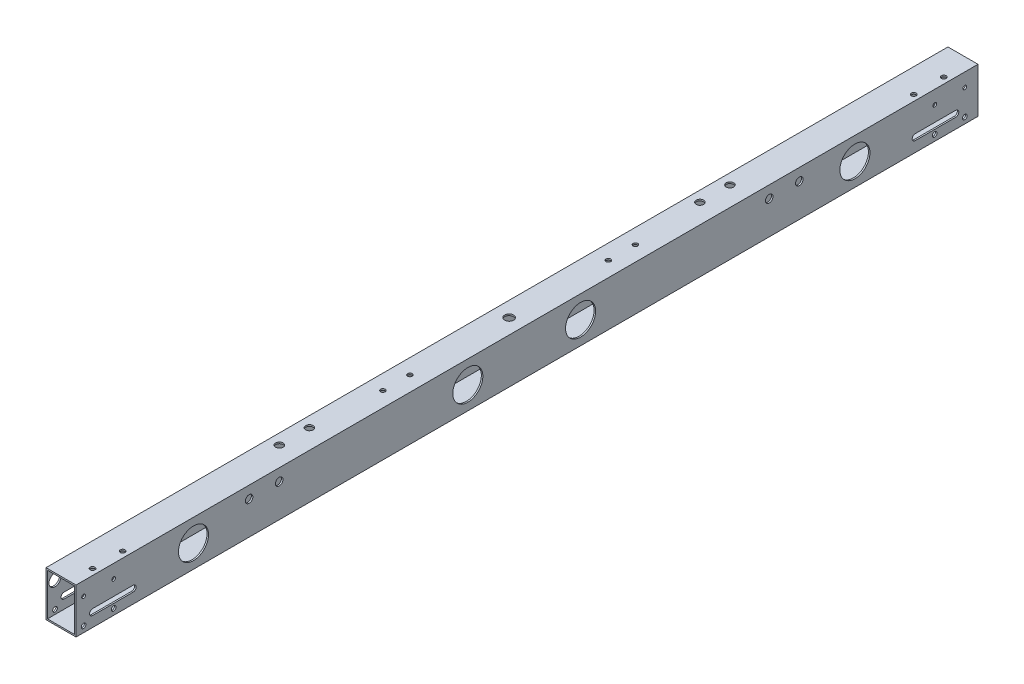
from build123d import *

# Parameters (mm, degrees)
SKETCH_1_W           = 20
SKETCH_1_H           = 30
SKETCH_1_W_2         = 18
SKETCH_1_H_2         = 28
EXTRUDE_1_DEPTH      = 600
SKETCH_2_R           = 1.55
SKETCH_2_R_2         = 3
CUT_EXTRUDE_1_DEPTH  = 5
SKETCH_5_R           = 5
CUT_EXTRUDE_6_DEPTH  = 10
SKETCH_7_R           = 1.25
CUT_EXTRUDE_7_DEPTH  = 25
SKETCH_8_R           = 4
CUT_EXTRUDE_8_DEPTH  = 3
SKETCH_10_R          = 1.6
CUT_EXTRUDE_9_DEPTH  = 40
SKETCH_11_R          = 2.5
CUT_EXTRUDE_10_DEPTH = 40
SKETCH_13_R          = 2.5
CUT_EXTRUDE_11_DEPTH = 40
CUT_EXTRUDE_12_DEPTH = 10
SKETCH_16_R          = 2.5
CUT_EXTRUDE_13_DEPTH = 50
SKETCH_17_R          = 2.5
CUT_EXTRUDE_14_DEPTH = 50
SKETCH_18_R          = 1.55
CUT_EXTRUDE_15_DEPTH = 40
SKETCH_19_R          = 1.55
CUT_EXTRUDE_16_DEPTH = 40
SKETCH_20_R          = 10
CUT_EXTRUDE_17_DEPTH = 40


with BuildPart() as part:
    # 草图1 → 凸台-拉伸1 (new body)
    with BuildSketch(Plane.XY):
        Rectangle(SKETCH_1_W, SKETCH_1_H)
        Rectangle(SKETCH_1_W_2, SKETCH_1_H_2, mode=Mode.SUBTRACT)
    extrude(amount=EXTRUDE_1_DEPTH)

    # 草图2 → 切除-拉伸1 (cut)
    with BuildSketch(Plane(origin=(0, 15, 0), x_dir=(1, 0, 0), z_dir=(0, 1, 0))):
        with Locations(Location((0, -217.88, 0), (0, 0, 270))):
            Circle(SKETCH_2_R)
        with Locations(Location((0, -235.88, 0), (0, 0, 270))):
            Circle(SKETCH_2_R)
        with Locations(Location((0, -367.88, 0), (0, 0, 270))):
            Circle(SKETCH_2_R)
        with Locations(Location((0, -385.88, 0), (0, 0, 270))):
            Circle(SKETCH_2_R)
        with Locations(Location((0, -301.88, 0), (0, 0, 270))):
            Circle(SKETCH_2_R_2)
    extrude(amount=-CUT_EXTRUDE_1_DEPTH, mode=Mode.SUBTRACT)

    # 草图5 → 切除-拉伸6 (cut)
    with BuildSketch(Plane(origin=(0, -14, 0), x_dir=(1, 0, 0), z_dir=(0, 1, 0))):
        with Locations(Location((0, -385.88, 0), (0, 0, 270))):
            Circle(SKETCH_5_R)
        with Locations(Location((0, -367.88, 0), (0, 0, 270))):
            Circle(SKETCH_5_R)
        with Locations(Location((0, -235.88, 0), (0, 0, 270))):
            Circle(SKETCH_5_R)
        with Locations(Location((0, -217.88, 0), (0, 0, 270))):
            Circle(SKETCH_5_R)
    extrude(amount=-CUT_EXTRUDE_6_DEPTH, mode=Mode.SUBTRACT)

    # 草图7 → 切除-拉伸7 (cut)
    with BuildSketch(Plane(origin=(10, 0, 0), x_dir=(0, 0, -1), z_dir=(1, 0, 0))):
        with BuildLine():
            ThreePointArc((-587, -6.1), (-587.585786438, -4.685786438), (-589, -4.1))
            Line((-589, -4.1), (-589, -8.1))
            ThreePointArc((-589, -8.1), (-587.585786438, -7.514213562), (-587, -6.1))
        make_face()
        with BuildLine():
            Line((-589, -8.1), (-589, -4.1))
            ThreePointArc((-589, -4.1), (-591, -6.1), (-589, -8.1))
        make_face()
        with BuildLine():
            Line((-562, -4.1), (-589, -4.1))
            ThreePointArc((-589, -4.1), (-587.585786438, -4.685786438), (-587, -6.1))
            ThreePointArc((-587, -6.1), (-587.585786438, -7.514213562), (-589, -8.1))
            Line((-589, -8.1), (-562, -8.1))
            ThreePointArc((-562, -8.1), (-564, -6.1), (-562, -4.1))
        make_face()
        with Locations((-595, 6)):
            Circle(SKETCH_7_R)
        with BuildLine():
            ThreePointArc((-560, -6.1), (-560.585786438, -4.685786438), (-562, -4.1))
            Line((-562, -4.1), (-562, -8.1))
            ThreePointArc((-562, -8.1), (-560.585786438, -7.514213562), (-560, -6.1))
        make_face()
        with BuildLine():
            Line((-562, -8.1), (-562, -4.1))
            ThreePointArc((-562, -4.1), (-564, -6.1), (-562, -8.1))
        make_face()
        with BuildLine():
            ThreePointArc((-39.76, -6.1), (-40.345786438, -4.685786438), (-41.76, -4.1))
            Line((-41.76, -4.1), (-41.76, -8.1))
            ThreePointArc((-41.76, -8.1), (-40.345786438, -7.514213562), (-39.76, -6.1))
        make_face()
        with BuildLine():
            Line((-41.76, -8.1), (-41.76, -4.1))
            ThreePointArc((-41.76, -4.1), (-43.76, -6.1), (-41.76, -8.1))
        make_face()
        with BuildLine():
            ThreePointArc((-14.76, -8.1), (-16.76, -6.1), (-14.76, -4.1))
            Line((-14.76, -4.1), (-41.76, -4.1))
            ThreePointArc((-41.76, -4.1), (-40.345786438, -4.685786438), (-39.76, -6.1))
            ThreePointArc((-39.76, -6.1), (-40.345786438, -7.514213562), (-41.76, -8.1))
            Line((-41.76, -8.1), (-14.76, -8.1))
        make_face()
        with BuildLine():
            ThreePointArc((-12.76, -6.1), (-13.345786438, -4.685786438), (-14.76, -4.1))
            Line((-14.76, -4.1), (-14.76, -8.1))
            ThreePointArc((-14.76, -8.1), (-13.345786438, -7.514213562), (-12.76, -6.1))
        make_face()
        with BuildLine():
            Line((-14.76, -8.1), (-14.76, -4.1))
            ThreePointArc((-14.76, -4.1), (-16.76, -6.1), (-14.76, -8.1))
        make_face()
        with Locations((-575, 6)):
            Circle(SKETCH_7_R)
        with Locations((-8.76, 6)):
            Circle(SKETCH_7_R)
        with Locations((-28.76, 6)):
            Circle(SKETCH_7_R)
    extrude(amount=-CUT_EXTRUDE_7_DEPTH, mode=Mode.SUBTRACT)

    # 草图8 → 切除-拉伸8 (cut)
    with BuildSketch(Plane.ZY.offset(10)):
        with Locations((8.76, 6)):
            Circle(SKETCH_8_R)
        with Locations((28.76, 6)):
            Circle(SKETCH_8_R)
        with Locations((575, 6)):
            Circle(SKETCH_8_R)
        with Locations((595, 6)):
            Circle(SKETCH_8_R)
    extrude(amount=-CUT_EXTRUDE_8_DEPTH, mode=Mode.SUBTRACT)

    # 草图10 → 切除-拉伸9 (cut)
    with BuildSketch(Plane(origin=(0, 15, 0), x_dir=(1, 0, 0), z_dir=(0, 1, 0))):
        with Locations(Location((6, -585, 0), (0, 0, 270))):
            Circle(SKETCH_10_R)
        with Locations(Location((6, -565, 0), (0, 0, 270))):
            Circle(SKETCH_10_R)
        with Locations(Location((6, -38.76, 0), (0, 0, 270))):
            Circle(SKETCH_10_R)
        with Locations(Location((6, -18.76, 0), (0, 0, 270))):
            Circle(SKETCH_10_R)
    extrude(amount=-CUT_EXTRUDE_9_DEPTH, mode=Mode.SUBTRACT)

    # 草图11 → 切除-拉伸10 (cut)
    with BuildSketch(Plane.XZ.offset(15)):
        with Locations(Location((-3, 152, 0), (0, 0, 270))):
            Circle(SKETCH_11_R)
        with Locations(Location((-3, 172, 0), (0, 0, 270))):
            Circle(SKETCH_11_R)
    extrude(amount=-CUT_EXTRUDE_10_DEPTH, mode=Mode.SUBTRACT)

    # 草图13 → 切除-拉伸11 (cut)
    with BuildSketch(Plane.XZ.offset(15)):
        with Locations(Location((-3, 431.76, 0), (0, 0, 270))):
            Circle(SKETCH_13_R)
        with Locations(Location((-3, 451.76, 0), (0, 0, 270))):
            Circle(SKETCH_13_R)
    extrude(amount=-CUT_EXTRUDE_11_DEPTH, mode=Mode.SUBTRACT)

    # 草图14 → 切除-拉伸12 (cut)
    with BuildSketch(Plane(origin=(0, -14, 0), x_dir=(1, 0, 0), z_dir=(0, 1, 0))):
        with BuildLine():
            Line((6, -291.88), (6, -311.88))
            ThreePointArc((6, -311.88), (0, -317.88), (-6, -311.88))
            Line((-6, -311.88), (-6, -291.88))
            ThreePointArc((-6, -291.88), (0, -285.88), (6, -291.88))
        make_face()
    extrude(amount=-CUT_EXTRUDE_12_DEPTH, mode=Mode.SUBTRACT)

    # 草图16 → 切除-拉伸13 (cut)
    with BuildSketch(Plane.ZY.offset(10)):
        with Locations((464.88, 7)):
            Circle(SKETCH_16_R)
        with Locations((484.88, 7)):
            Circle(SKETCH_16_R)
    extrude(amount=-CUT_EXTRUDE_13_DEPTH, mode=Mode.SUBTRACT)

    # 草图17 → 切除-拉伸14 (cut)
    with BuildSketch(Plane.ZY.offset(10)):
        with Locations((118.88, 7)):
            Circle(SKETCH_17_R)
        with Locations((138.88, 7)):
            Circle(SKETCH_17_R)
    extrude(amount=-CUT_EXTRUDE_14_DEPTH, mode=Mode.SUBTRACT)

    # 草图18 → 切除-拉伸15 (cut)
    with BuildSketch(Plane(origin=(10, 0, 0), x_dir=(0, 0, -1), z_dir=(1, 0, 0))):
        with Locations((-28.76, -11)):
            Circle(SKETCH_18_R)
        with Locations((-8.76, -11)):
            Circle(SKETCH_18_R)
    extrude(amount=-CUT_EXTRUDE_15_DEPTH, mode=Mode.SUBTRACT)

    # 草图19 → 切除-拉伸16 (cut)
    with BuildSketch(Plane(origin=(10, 0, 0), x_dir=(0, 0, -1), z_dir=(1, 0, 0))):
        with Locations((-575, -11)):
            Circle(SKETCH_19_R)
        with Locations((-595, -11)):
            Circle(SKETCH_19_R)
    extrude(amount=-CUT_EXTRUDE_16_DEPTH, mode=Mode.SUBTRACT)

    # 草图20 → 切除-拉伸17 (cut)
    with BuildSketch(Plane.ZY.offset(10)):
        with Locations((81.88, 0)):
            Circle(SKETCH_20_R)
        with Locations((264.38, 0)):
            Circle(SKETCH_20_R)
        with Locations((339.38, 0)):
            Circle(SKETCH_20_R)
        with Locations((521.88, 0)):
            Circle(SKETCH_20_R)
    extrude(amount=-CUT_EXTRUDE_17_DEPTH, mode=Mode.SUBTRACT)


solid = part.part
